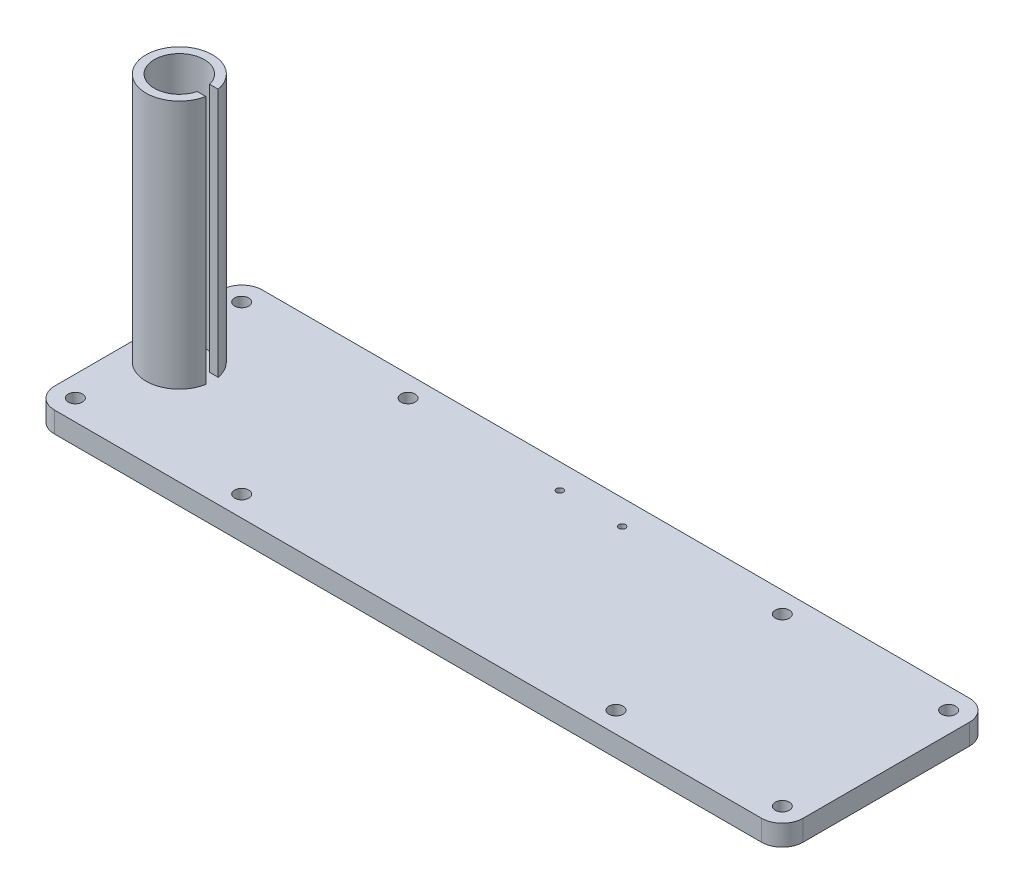
from build123d import *

# Parameters (mm, degrees)
SKETCH_1_W          = 100
SKETCH_1_H          = 50
SKETCH_1_R          = 1.7
EXTRUDE_1_DEPTH     = 5
HOLE_WIZARD_M2_2_D  = 1.6
SKETCH_8_R          = 8
SKETCH_8_R_2        = 6
EXTRUDE_1_2_DEPTH   = 60
CUT_EXTRUDE_START   = -60
CUT_EXTRUDE_1_DEPTH = 60


with BuildPart() as part:
    # 草图1 → Extrude 1 (new body)
    # profile 1 of 3: a face of its own
    with BuildSketch(Plane(origin=(0, 0, 0), x_dir=(1, 0, 0), z_dir=(0, 1, 0))):
        Rectangle(SKETCH_1_W, SKETCH_1_H)
        with Locations(Location((-45, -20, 0), (0, 0, 270))):
            Circle(SKETCH_1_R, mode=Mode.SUBTRACT)
        with Locations(Location((45, -20, 0), (0, 0, 270))):
            Circle(SKETCH_1_R, mode=Mode.SUBTRACT)
        with Locations(Location((-45, 20, 0), (0, 0, 270))):
            Circle(SKETCH_1_R, mode=Mode.SUBTRACT)
        with Locations(Location((45, 20, 0), (0, 0, 270))):
            Circle(SKETCH_1_R, mode=Mode.SUBTRACT)
    # profile 2 of 3: a face of its own
    with BuildSketch(Plane(origin=(0, 0, 0), x_dir=(1, 0, 0), z_dir=(0, 1, 0))):
        with BuildLine():
            Line((-50, 25), (-85, 25))
            ThreePointArc((-85, 25), (-88.535533906, 23.535533906), (-90, 20))
            Line((-90, 20), (-90, -20))
            ThreePointArc((-90, -20), (-88.535533906, -23.535533906), (-85, -25))
            Line((-85, -25), (-50, -25))
            Line((-50, -25), (-50, 25))
        make_face()
        with Locations(Location((-85, -20, 0), (0, 0, 270))):
            Circle(SKETCH_1_R, mode=Mode.SUBTRACT)
        with Locations(Location((-85, 20, 0), (0, 0, 270))):
            Circle(SKETCH_1_R, mode=Mode.SUBTRACT)
    # profile 3 of 3: a face of its own
    with BuildSketch(Plane(origin=(0, 0, 0), x_dir=(1, 0, 0), z_dir=(0, 1, 0))):
        with BuildLine():
            Line((85, 25), (50, 25))
            Line((50, 25), (50, -25))
            Line((50, -25), (85, -25))
            ThreePointArc((85, -25), (88.535533906, -23.535533906), (90, -20))
            Line((90, -20), (90, 20))
            ThreePointArc((90, 20), (88.535533906, 23.535533906), (85, 25))
        make_face()
        with Locations(Location((85, -20, 0), (0, 0, 270))):
            Circle(SKETCH_1_R, mode=Mode.SUBTRACT)
        with Locations(Location((85, 20, 0), (0, 0, 270))):
            Circle(SKETCH_1_R, mode=Mode.SUBTRACT)
    extrude(amount=EXTRUDE_1_DEPTH)

    # M2 螺纹孔2 (through all)
    with Locations(Plane(origin=(0, 5, 0), x_dir=(1, 0, 0), z_dir=(0, 1, 0))):
        with Locations((-7.5, 19), (7.5, 19)):
            Hole(HOLE_WIZARD_M2_2_D / 2)

    # 草图8 → Extrude 1 2 (add)
    with BuildSketch(Plane(origin=(0, 5, 0), x_dir=(1, 0, 0), z_dir=(0, 1, 0))):
        with Locations((-80, 0)):
            Circle(SKETCH_8_R)
        with Locations((-80, 0)):
            Circle(SKETCH_8_R_2, mode=Mode.SUBTRACT)
    extrude(amount=EXTRUDE_1_2_DEPTH)

    # 草图9 → 切除-拉伸1 (cut)
    with BuildSketch(Plane(origin=(0, 65, 0), x_dir=(1, 0, 0), z_dir=(0, 1, 0)).offset(CUT_EXTRUDE_START)):
        with BuildLine():
            Line((-74.190524981, 1.5), (-72.141883177, 1.5))
            ThreePointArc((-72.141883177, 1.5), (-72, 0), (-72.141883177, -1.5))
            Line((-72.141883177, -1.5), (-74.190524981, -1.5))
            ThreePointArc((-74.190524981, -1.5), (-74, 0), (-74.190524981, 1.5))
        make_face()
    extrude(amount=CUT_EXTRUDE_1_DEPTH, mode=Mode.SUBTRACT)


solid = part.part
